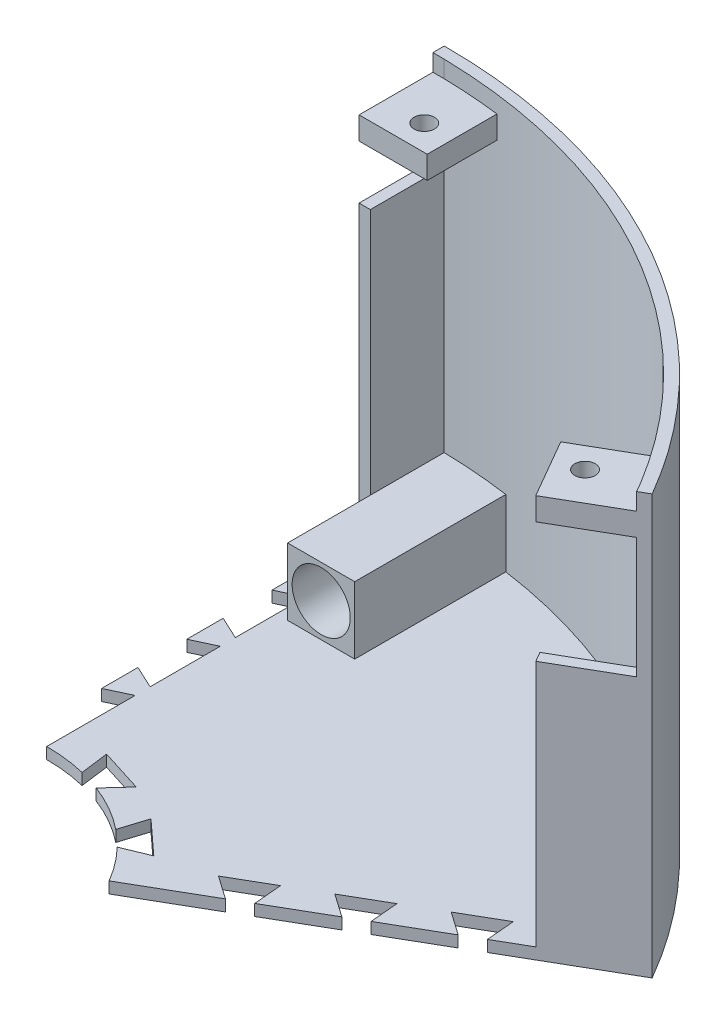
from build123d import *

# Parameters (mm, degrees)
BOSS_EXTRUDE1_DEPTH      = 2.54
BOSS_EXTRUDE2_DEPTH      = 91.2
CUT_EXTRUDE2_START       = -25.908
CUT_EXTRUDE2_DEPTH       = 25.908
CUT_EXTRUDE3_DEPTH       = 25.908
BOSS_EXTRUDE3_DEPTH      = 2.54
BOSS_EXTRUDE6_START      = -8.89
BOSS_EXTRUDE6_DEPTH      = 5.08
CUT_EXTRUDE4_REACH       = 192.56
SKETCH12_R               = 2.286
SKETCH14_W               = 2.52
SKETCH14_H               = 16.504489674
CUT_EXTRUDE5_DEPTH       = 3.81
SKETCH20_W               = 2.52
SKETCH20_H               = 12
CUT_EXTRUDE8_DEPTH       = 16.50449
SKETCH21_W               = 2.52
SKETCH21_H               = 27
CUT_EXTRUDE9_DEPTH       = 16.504491
BOSS_EXTRUDE7_DEPTH      = 15
CUT_EXTRUDE10_REACH      = 162.751
CUT_EXTRUDE10_END_RADIUS = 127
SKETCH23_R               = 6.5


with BuildPart() as part:
    # Sketch3 → Boss-Extrude1 (new body)
    with BuildSketch(Plane(origin=(0, 0, 0), x_dir=(1, 0, 0), z_dir=(0, 1, 0))):
        with BuildLine():
            Line((0, 127), (0, 38.1))
            ThreePointArc((0, 38.1), (19.05, 32.995567884), (32.995567884, 19.05))
            Line((32.995567884, 19.05), (109.985226281, 63.5))
            ThreePointArc((109.985226281, 63.5), (63.5, 109.985226281), (0, 127))
        make_face()
    extrude(amount=BOSS_EXTRUDE1_DEPTH)

    # Sketch4 → Boss-Extrude2 (add)
    with BuildSketch(Plane(origin=(0, 2.54, 0), x_dir=(1, 0, 0), z_dir=(0, 1, 0))):
        with BuildLine():
            Line((0, 127), (0, 107.95))
            Line((0, 107.95), (2.52, 107.95))
            Line((2.52, 107.95), (2.52, 124.454489674))
            ThreePointArc((2.52, 124.454489674), (62.24, 107.802842263), (106.520749673, 64.409628855))
            Line((106.520749673, 64.409628855), (92.227442339, 56.157384018))
            Line((92.227442339, 56.157384018), (93.487442339, 53.975))
            Line((93.487442339, 53.975), (109.985226281, 63.5))
            ThreePointArc((109.985226281, 63.5), (63.5, 109.985226281), (0, 127))
        make_face()
    extrude(amount=BOSS_EXTRUDE2_DEPTH)

    # Sketch5 → Cut-Extrude2 (cut)
    with BuildSketch(Plane(origin=(0, 2.54, 0), x_dir=(1, 0, 0), z_dir=(0, 1, 0)).offset(CUT_EXTRUDE2_START)):
        with BuildLine():
            Line((17.850324991, 40.264829059), (8.160560772, 43.319999982))
            Line((8.160560772, 43.319999982), (8.989402092, 37.024325112))
            ThreePointArc((8.989402092, 37.024325112), (11.304821498, 36.384213759), (13.575298322, 35.599456112))
            Line((13.575298322, 35.599456112), (17.850324991, 40.264829059))
        make_face()
        with BuildLine():
            Line((25.661648149, 35.754959531), (23.775129005, 29.77168522))
            ThreePointArc((23.775129005, 29.77168522), (25.627908389, 28.192557734), (27.37605765, 26.498329524))
            Line((27.37605765, 26.498329524), (33.152385891, 28.890963022))
            Line((33.152385891, 28.890963022), (25.661648149, 35.754959531))
        make_face()
    extrude(amount=CUT_EXTRUDE2_DEPTH, mode=Mode.SUBTRACT)

    # Sketch6 → Cut-Extrude3 (cut)
    with BuildSketch(Plane(origin=(0, 2.54, 0), x_dir=(1, 0, 0), z_dir=(0, 1, 0))):
        Polygon((49.493351826, 28.575), (44.291736345, 32.217210371), (53.090554447, 37.297210371), (53.643993414, 30.971374038), align=None)
        Polygon((65.991135768, 38.1), (70.141777356, 40.496374038), (69.58833839, 46.822210371), (60.789520287, 41.742210371), align=None)
        Polygon((82.48891971, 47.625), (86.639561298, 50.021374038), (86.086122332, 56.347210371), (77.287304229, 51.267210371), align=None)
    extrude(amount=-CUT_EXTRUDE3_DEPTH, mode=Mode.SUBTRACT)

    # Sketch7 → Boss-Extrude3 (add)
    with BuildSketch(Plane(origin=(0, 2.54, 0), x_dir=(1, 0, 0), z_dir=(0, 1, 0))):
        Polygon((0, 95.967195647), (0, 99.325552429), (-5.105054448, 101.706078413), (-5.105054448, 93.586669663), align=None)
        Polygon((0, 76.917195647), (0, 80.275552429), (-5.105054448, 82.656078413), (-5.105054448, 74.536669663), align=None)
        Polygon((0, 57.867195647), (0, 61.225552429), (-5.105054448, 63.606078413), (-5.105054448, 55.486669663), align=None)
    extrude(amount=-BOSS_EXTRUDE3_DEPTH)

    # Sketch9 → Boss-Extrude6 (add)
    with BuildSketch(Plane(origin=(0, 93.74, 0), x_dir=(1, 0, 0), z_dir=(0, 1, 0)).offset(BOSS_EXTRUDE6_START)):
        with BuildLine():
            Line((2.52, 124.454489674), (2.52, 107.95))
            Line((2.52, 107.95), (15.24, 107.95))
            Line((15.24, 107.95), (15.24, 123.543566405))
            ThreePointArc((15.24, 123.543566405), (8.891672807, 124.162025413), (2.52, 124.454489674))
        make_face()
        with BuildLine():
            ThreePointArc((106.520749673, 64.409628855), (103.08163179, 69.781427239), (99.371866981, 74.970010356))
            Line((99.371866981, 74.970010356), (85.867442339, 67.173227154))
            Line((85.867442339, 67.173227154), (92.227442339, 56.157384018))
            Line((92.227442339, 56.157384018), (106.520749673, 64.409628855))
        make_face()
    extrude(amount=BOSS_EXTRUDE6_DEPTH)

    # Sketch12 → Cut-Extrude4 (cut, up to next)
    with BuildSketch(Plane(origin=(0, 89.93, 0), x_dir=(1, 0, 0), z_dir=(0, 1, 0)), mode=Mode.PRIVATE) as cut_extrude4_sk1:
        with Locations(Location((8.89, 113.627157306, 0), (0, 0, 270))):
            Circle(SKETCH12_R)
    cut_extrude4_tool1 = extrude(cut_extrude4_sk1.sketch, amount=-CUT_EXTRUDE4_REACH, mode=Mode.PRIVATE) & part.part
    # Sketch12 → Cut-Extrude4 (cut, up to next)
    with BuildSketch(Plane(origin=(0, 89.93, 0), x_dir=(1, 0, 0), z_dir=(0, 1, 0)), mode=Mode.PRIVATE) as cut_extrude4_sk2:
        with Locations(Location((93.959004787, 64.512544493, 0), (0, 0, 270))):
            Circle(SKETCH12_R)
    cut_extrude4_tool2 = extrude(cut_extrude4_sk2.sketch, amount=-CUT_EXTRUDE4_REACH, mode=Mode.PRIVATE) & part.part
    add(cut_extrude4_tool1.solids().sort_by_distance((8.89, 89.93, -113.627157))[0], mode=Mode.SUBTRACT)
    add(cut_extrude4_tool2.solids().sort_by_distance((93.959005, 89.93, -64.512544))[0], mode=Mode.SUBTRACT)

    # Sketch14 → Cut-Extrude5 (cut)
    with BuildSketch(Plane(origin=(0, 93.74, 0), x_dir=(1, 0, 0), z_dir=(0, 1, 0))):
        with Locations((1.26, 116.202244837)):
            Rectangle(SKETCH14_W, SKETCH14_H)
        Polygon((106.520749673, 64.409628855), (107.780749673, 62.227244837), (93.487442339, 53.975), (92.227442339, 56.157384018), align=None)
    extrude(amount=-CUT_EXTRUDE5_DEPTH, mode=Mode.SUBTRACT)

    # Sketch20 → Cut-Extrude8 (cut)
    with BuildSketch(Plane.XY.offset(-107.95)):
        with Locations((1.26, 78.85)):
            Rectangle(SKETCH20_W, SKETCH20_H)
    extrude(amount=-CUT_EXTRUDE8_DEPTH, mode=Mode.SUBTRACT)

    # Sketch21 → Cut-Extrude9 (cut)
    with BuildSketch(Plane(origin=(93.487442339, 0, -53.975), x_dir=(0.500000000000006, 0, 0.8660254037844352), z_dir=(-0.8660254037844352, 0, 0.500000000000006))):
        with Locations((-1.26, 71.35)):
            Rectangle(SKETCH21_W, SKETCH21_H)
    extrude(amount=-CUT_EXTRUDE9_DEPTH, mode=Mode.SUBTRACT)

    # Sketch22 → Boss-Extrude7 (add)
    with BuildSketch(Plane(origin=(0, 2.54, 0), x_dir=(1, 0, 0), z_dir=(0, 1, 0))):
        with BuildLine():
            Line((2.52, 124.454489674), (2.52, 89.454489674))
            Line((2.52, 89.454489674), (17.52, 89.454489674))
            Line((17.52, 89.454489674), (17.52, 123.240902301))
            ThreePointArc((17.52, 123.240902301), (10.038356368, 124.074581609), (2.52, 124.454489674))
        make_face()
    extrude(amount=BOSS_EXTRUDE7_DEPTH)

    # Cut-Extrude10: up to this cylinder (the profile starts inside it)
    cut_extrude10_end = Plane(origin=(0, 10.04, 0), z_dir=(0, -1, 0)) * Cylinder(CUT_EXTRUDE10_END_RADIUS, 580.502, mode=Mode.PRIVATE)
    # Sketch23 → Cut-Extrude10 (cut, up to the surface)
    with BuildSketch(Plane.XY.offset(-89.454489674), mode=Mode.PRIVATE) as cut_extrude10_sk1:
        with Locations((10.02, 10.04)):
            Circle(SKETCH23_R)
    cut_extrude10_tool1 = extrude(cut_extrude10_sk1.sketch, amount=-CUT_EXTRUDE10_REACH, mode=Mode.PRIVATE) & cut_extrude10_end
    add(cut_extrude10_tool1.solids().sort_by_distance((10.02, 10.04, -89.45449))[0], mode=Mode.SUBTRACT)


solid = part.part
